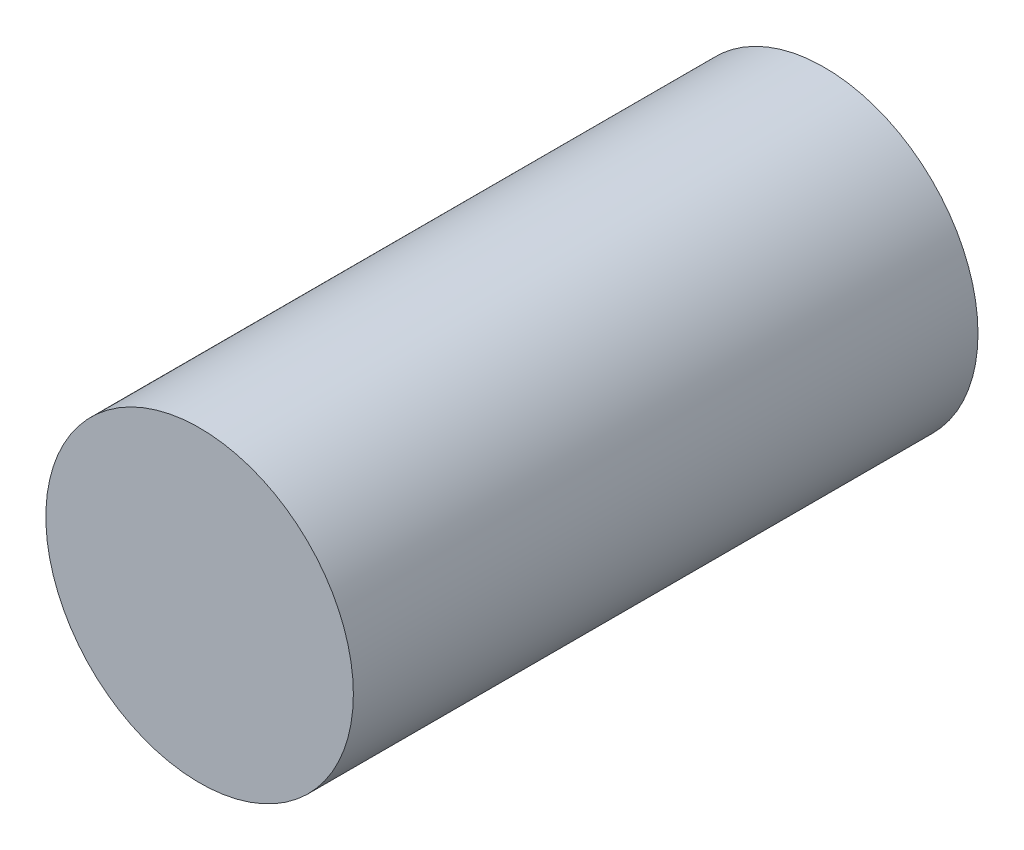
from build123d import *

# Parameters (mm, degrees)
SKETCH1_R           = 16
BOSS_EXTRUDE1_DEPTH = 65


with BuildPart() as part:
    # Sketch1 → Boss-Extrude1 (new body)
    with BuildSketch(Plane.XY):
        Circle(SKETCH1_R)
    extrude(amount=BOSS_EXTRUDE1_DEPTH)


solid = part.part
